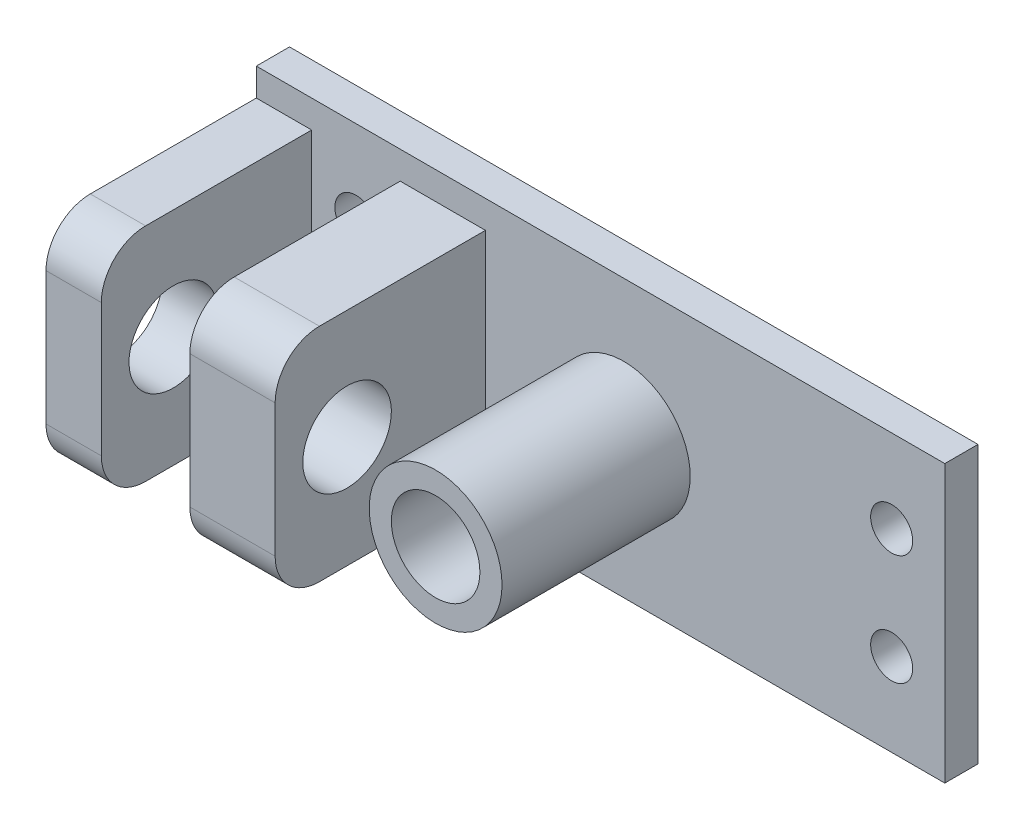
from build123d import *

# Parameters (mm, degrees)
SKETCH1_W           = 58
SKETCH1_H           = 25
SKETCH1_R           = 1.9
BOSS_EXTRUDE1_DEPTH = 3
SKETCH2_R           = 6
BOSS_EXTRUDE2_DEPTH = 20
SKETCH3_R           = 4
CUT_EXTRUDE1_DEPTH  = 38.379807383
SKETCH4_W           = 7.7
SKETCH4_H           = 19.996282454
BOSS_EXTRUDE3_DEPTH = 19
CUT_EXTRUDE2_REACH  = 57.325
SKETCH5_R           = 4
FILLET1_R           = 4
SKETCH7_W           = 4.2
SKETCH7_H           = 25
BOSS_EXTRUDE4_DEPTH = 3
SKETCH8_W           = 5
SKETCH8_H           = 19.996282454
BOSS_EXTRUDE5_DEPTH = 19
CUT_EXTRUDE3_REACH  = 64.547
SKETCH9_R           = 4
FILLET2_R           = 4


with BuildPart() as part:
    # Sketch1 → Boss-Extrude1 (new body)
    with BuildSketch(Plane.XY):
        Rectangle(SKETCH1_W, SKETCH1_H)
        with Locations((24.2, 5)):
            Circle(SKETCH1_R, mode=Mode.SUBTRACT)
        with Locations((24.2, -5)):
            Circle(SKETCH1_R, mode=Mode.SUBTRACT)
        with Locations((-24.2, 5)):
            Circle(SKETCH1_R, mode=Mode.SUBTRACT)
        with Locations((-24.2, -5)):
            Circle(SKETCH1_R, mode=Mode.SUBTRACT)
    extrude(amount=BOSS_EXTRUDE1_DEPTH)

    # Sketch2 → Boss-Extrude2 (add)
    with BuildSketch(Plane.XY):
        Circle(SKETCH2_R)
    extrude(amount=BOSS_EXTRUDE2_DEPTH)

    # Sketch3 → Cut-Extrude1 (cut, through all)
    with BuildSketch(Plane.XY.offset(20)):
        Circle(SKETCH3_R)
    extrude(amount=-CUT_EXTRUDE1_DEPTH, mode=Mode.SUBTRACT)

    # Sketch4 → Boss-Extrude3 (add)
    with BuildSketch(Plane.XY.offset(3)):
        with Locations((-16.35, 0)):
            Rectangle(SKETCH4_W, SKETCH4_H)
    extrude(amount=BOSS_EXTRUDE3_DEPTH)

    # Sketch5 → Cut-Extrude2 (cut, up to next)
    with BuildSketch(Plane.ZY.offset(20.2), mode=Mode.PRIVATE) as cut_extrude2_sk1:
        with Locations((15.5, 0.080826905)):
            Circle(SKETCH5_R)
    cut_extrude2_tool1 = extrude(cut_extrude2_sk1.sketch, amount=-CUT_EXTRUDE2_REACH, mode=Mode.PRIVATE) & part.part
    add(cut_extrude2_tool1.solids().sort_by_distance((-20.2, 0.080827, 15.5))[0], mode=Mode.SUBTRACT)

    # Fillet1
    fillet1_edges = [part.edges().sort_by_distance(p)[0] for p in [
        (-16.35, 9.998141227, 22),
        (-16.35, -9.998141227, 22),
    ]]
    fillet(fillet1_edges, radius=FILLET1_R)

    # Sketch7 → Boss-Extrude4 (add)
    with BuildSketch(Plane.XY.offset(3)):
        with Locations((-31.1, 0)):
            Rectangle(SKETCH7_W, SKETCH7_H)
    extrude(amount=-BOSS_EXTRUDE4_DEPTH)

    # Sketch8 → Boss-Extrude5 (add)
    with BuildSketch(Plane.XY.offset(3)):
        with Locations((-30.7, 0)):
            Rectangle(SKETCH8_W, SKETCH8_H)
    extrude(amount=BOSS_EXTRUDE5_DEPTH)

    # Sketch9 → Cut-Extrude3 (cut, up to next)
    with BuildSketch(Plane(origin=(-28.2, 0, 0), x_dir=(0, 0, -1), z_dir=(1, 0, 0)), mode=Mode.PRIVATE) as cut_extrude3_sk1:
        with Locations(Location((-15.5, 0.063578072, 0), (0, 0, 90))):
            Circle(SKETCH9_R)
    cut_extrude3_tool1 = extrude(cut_extrude3_sk1.sketch, amount=-CUT_EXTRUDE3_REACH, mode=Mode.PRIVATE) & part.part
    add(cut_extrude3_tool1.solids().sort_by_distance((-28.2, 0.063578, 15.5))[0], mode=Mode.SUBTRACT)

    # Fillet2
    fillet2_edges = [part.edges().sort_by_distance(p)[0] for p in [
        (-30.7, 9.998141227, 22),
        (-30.7, -9.998141227, 22),
    ]]
    fillet(fillet2_edges, radius=FILLET2_R)


solid = part.part
